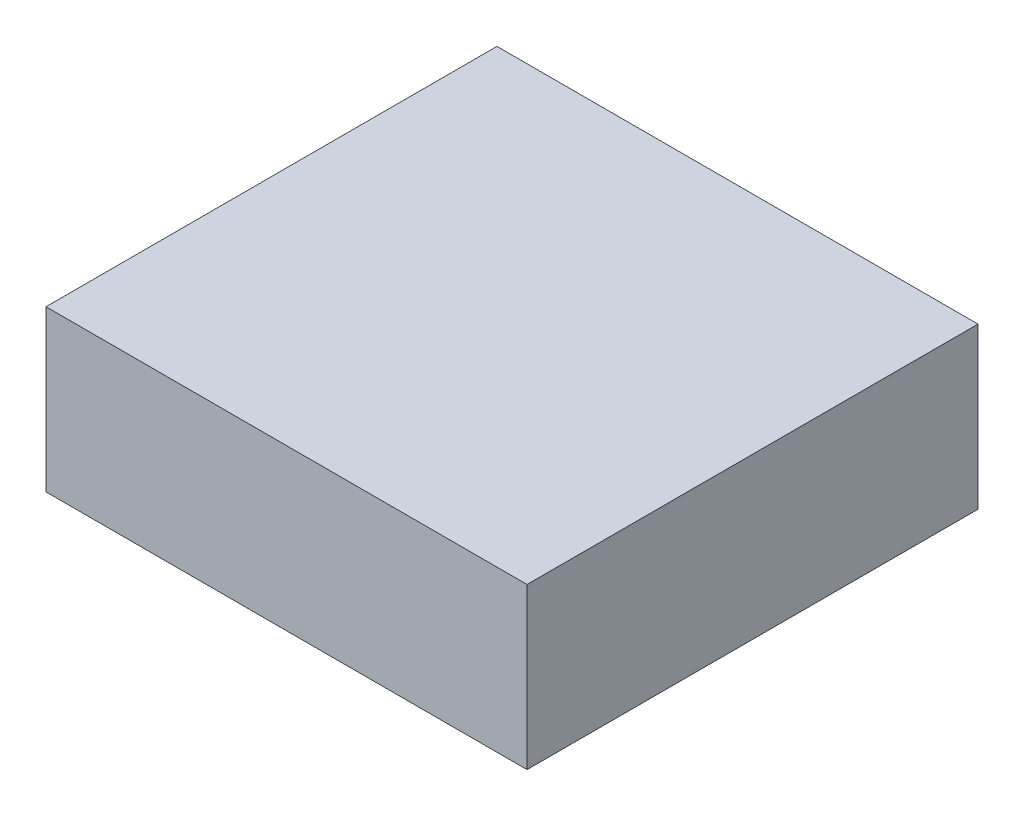
from build123d import *

# Parameters (mm, degrees)
SKETCH_1_W      = 96
SKETCH_1_H      = 90
EXTRUDE_1_DEPTH = 32


with BuildPart() as part:
    # Эскиз1 → Бобышка-Вытянуть1 (new body)
    with BuildSketch(Plane(origin=(0, 0, 0), x_dir=(1, 0, 0), z_dir=(0, 1, 0))):
        Rectangle(SKETCH_1_W, SKETCH_1_H)
    extrude(amount=EXTRUDE_1_DEPTH)


solid = part.part
